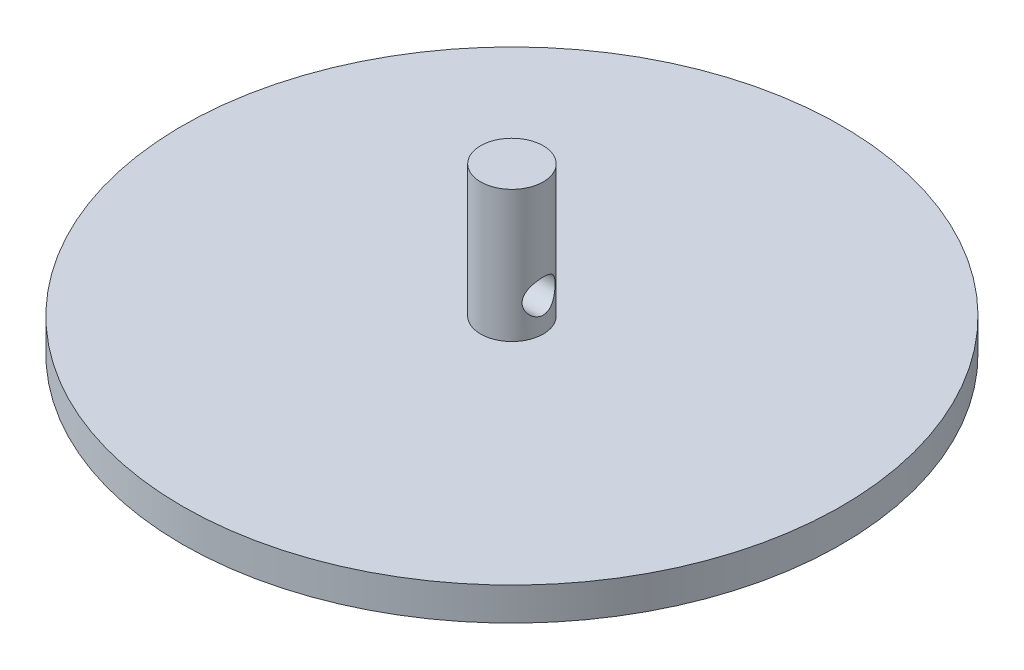
from build123d import *

# Parameters (mm, degrees)
SKETCH1_R               = 50
BOSS_EXTRUDE1_DEPTH     = 5
SKETCH2_R               = 4.75
BOSS_EXTRUDE2_DEPTH     = 20
CUT_EXTRUDE1_REACH      = 80.247
CUT_EXTRUDE1_END_RADIUS = 4.75
SKETCH3_R               = 2.5


with BuildPart() as part:
    # Sketch1 → Boss-Extrude1 (new body)
    with BuildSketch(Plane(origin=(0, 0, 0), x_dir=(1, 0, 0), z_dir=(0, 1, 0))):
        with Locations(Location((0, 0, 0), (0, 0, 270))):
            Circle(SKETCH1_R)
    extrude(amount=BOSS_EXTRUDE1_DEPTH)

    # Sketch2 → Boss-Extrude2 (add)
    with BuildSketch(Plane(origin=(0, 5, 0), x_dir=(1, 0, 0), z_dir=(0, 1, 0))):
        with Locations(Location((0, 0, 0), (0, 0, 270))):
            Circle(SKETCH2_R)
    extrude(amount=BOSS_EXTRUDE2_DEPTH)

    # Cut-Extrude1: up to this cylinder (the profile starts inside it)
    cut_extrude1_end = Plane(origin=(0, 10, 0), z_dir=(0, -1, 0)) * Cylinder(CUT_EXTRUDE1_END_RADIUS, 170.994, mode=Mode.PRIVATE)
    # Sketch3 → Cut-Extrude1 (cut, up to the surface)
    with BuildSketch(Plane(origin=(4.75, 0, 0), x_dir=(0, 0, -1), z_dir=(1, 0, 0)), mode=Mode.PRIVATE) as cut_extrude1_sk1:
        with Locations((0, 10)):
            Circle(SKETCH3_R)
    cut_extrude1_tool1 = extrude(cut_extrude1_sk1.sketch, amount=-CUT_EXTRUDE1_REACH, mode=Mode.PRIVATE) & cut_extrude1_end
    add(cut_extrude1_tool1.solids().sort_by_distance((4.75, 10, 0))[0], mode=Mode.SUBTRACT)


solid = part.part
